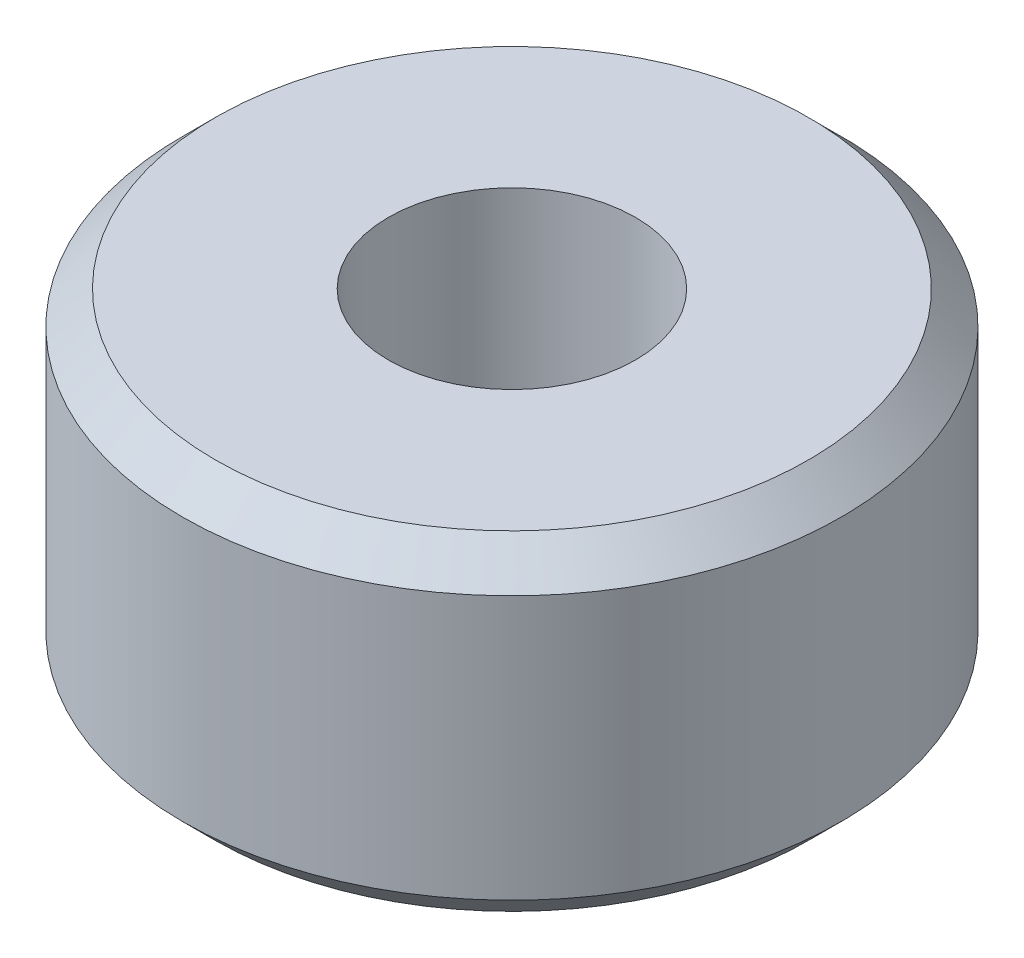
from build123d import *

# Parameters (mm, degrees)
SKETCH_1_R      = 4
SKETCH_1_R_2    = 1.5
EXTRUDE_1_DEPTH = 4
CHAMFER_1_SIZE  = 0.4


with BuildPart() as part:
    # 草图1 → 凸台-拉伸1 (new body)
    with BuildSketch(Plane(origin=(0, 0, 0), x_dir=(1, 0, 0), z_dir=(0, 1, 0))):
        with Locations(Location((0, 0, 0), (0, 0, 270))):
            Circle(SKETCH_1_R)
        with Locations(Location((0, 0, 0), (0, 0, 270))):
            Circle(SKETCH_1_R_2, mode=Mode.SUBTRACT)
    extrude(amount=EXTRUDE_1_DEPTH)

    # 倒角1
    chamfer_1_edges = [part.edges().sort_by_distance(p)[0] for p in [
        (0, 0, -4),
        (0, 4, -4),
    ]]
    chamfer(chamfer_1_edges, length=CHAMFER_1_SIZE)


solid = part.part
